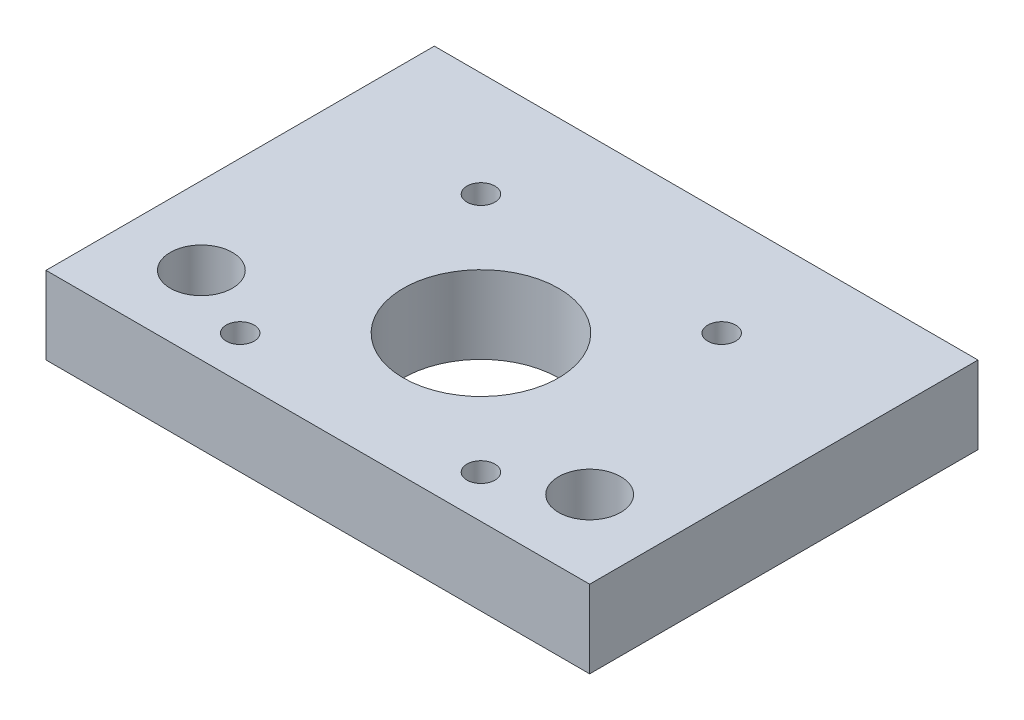
from build123d import *

# Parameters (mm, degrees)
SKETCH2_W                                            = 70
SKETCH2_H                                            = 50
BOSS_EXTRUDE1_DEPTH                                  = 10
SKETCH3_R                                            = 4
CUT_EXTRUDE1_DEPTH                                   = 45.158804332
SKETCH4_R                                            = 1.8
CUT_EXTRUDE2_DEPTH                                   = 45.158804332
SKETCH5_R                                            = 10
CUT_EXTRUDE3_DEPTH                                   = 45.158804332
CSK_FOR_M3_SOCKET_COUNTERSUNK_HEAD_SCREW_D           = 3.4
CSK_FOR_M3_SOCKET_COUNTERSUNK_HEAD_SCREW_CSINK_D     = 6.94
CSK_FOR_M3_SOCKET_COUNTERSUNK_HEAD_SCREW_CSINK_ANGLE = 90


with BuildPart() as part:
    # Sketch2 → Boss-Extrude1 (new body)
    with BuildSketch(Plane(origin=(0, 0, 0), x_dir=(1, 0, 0), z_dir=(0, 1, 0))):
        Rectangle(SKETCH2_W, SKETCH2_H)
    extrude(amount=BOSS_EXTRUDE1_DEPTH)

    # Sketch3 → Cut-Extrude1 (cut, through all)
    with BuildSketch(Plane(origin=(0, 10, 0), x_dir=(1, 0, 0), z_dir=(0, 1, 0))):
        with Locations(Location((-25, -15, 0), (0, 0, 270))):
            Circle(SKETCH3_R)
        with Locations(Location((25, -15, 0), (0, 0, 90))):
            Circle(SKETCH3_R)
    extrude(amount=-CUT_EXTRUDE1_DEPTH, mode=Mode.SUBTRACT)

    # Sketch4 → Cut-Extrude2 (cut, through all)
    with BuildSketch(Plane.XZ):
        with Locations(Location((-15.5, 19.5, 0), (0, 0, 270))):
            Circle(SKETCH4_R)
        with Locations(Location((-15.5, -11.5, 0), (0, 0, 270))):
            Circle(SKETCH4_R)
        with Locations(Location((15.5, -11.5, 0), (0, 0, 270))):
            Circle(SKETCH4_R)
        with Locations(Location((15.5, 19.5, 0), (0, 0, 270))):
            Circle(SKETCH4_R)
    extrude(amount=-CUT_EXTRUDE2_DEPTH, mode=Mode.SUBTRACT)

    # Sketch5 → Cut-Extrude3 (cut, through all)
    with BuildSketch(Plane.XZ):
        with Locations(Location((0, 4, 0), (0, 0, 270))):
            Circle(SKETCH5_R)
    extrude(amount=-CUT_EXTRUDE3_DEPTH, mode=Mode.SUBTRACT)

    # CSK for M3 socket countersunk head screw1 (through all)
    with Locations(Plane.XZ):
        with Locations((-15.5, 19.5), (15.5, 19.5), (15.5, -11.5), (-15.5, -11.5)):
            CounterSinkHole(CSK_FOR_M3_SOCKET_COUNTERSUNK_HEAD_SCREW_D / 2, CSK_FOR_M3_SOCKET_COUNTERSUNK_HEAD_SCREW_CSINK_D / 2, counter_sink_angle=CSK_FOR_M3_SOCKET_COUNTERSUNK_HEAD_SCREW_CSINK_ANGLE)


solid = part.part
